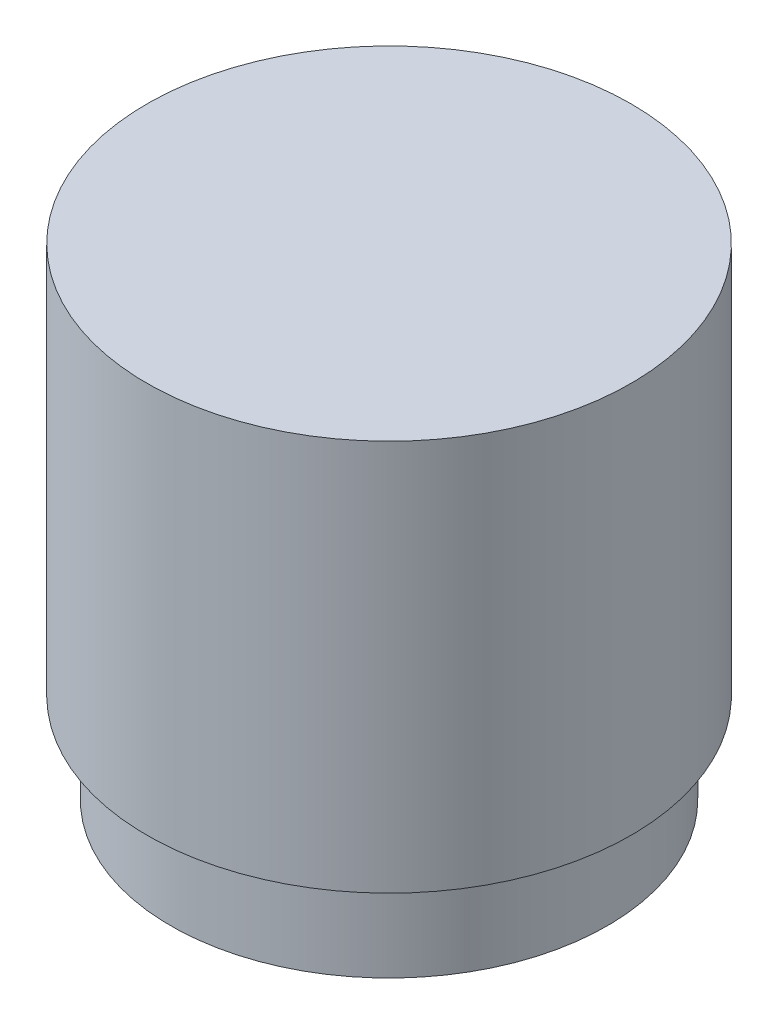
from build123d import *


with BuildPart() as part:
    # Sketch1 → Revolve1 (revolve)
    with BuildSketch(Plane.XY, mode=Mode.PRIVATE) as revolve1_sk:
        Polygon((-7.25, 0), (-7.25, 3), (-8.04, 3), (-8.04, 16), (0, 16), (0, 13.57), (-2.91, 13.57), (-2.91, 4.3), (-6.375, 4.3), (-6.375, 0), align=None)
    revolve(revolve1_sk.sketch.rotate(Axis((0, 0, 0), (0, 1, 0)), 270), axis=Axis((0, 0, 0), (0, 1, 0)))


solid = part.part
